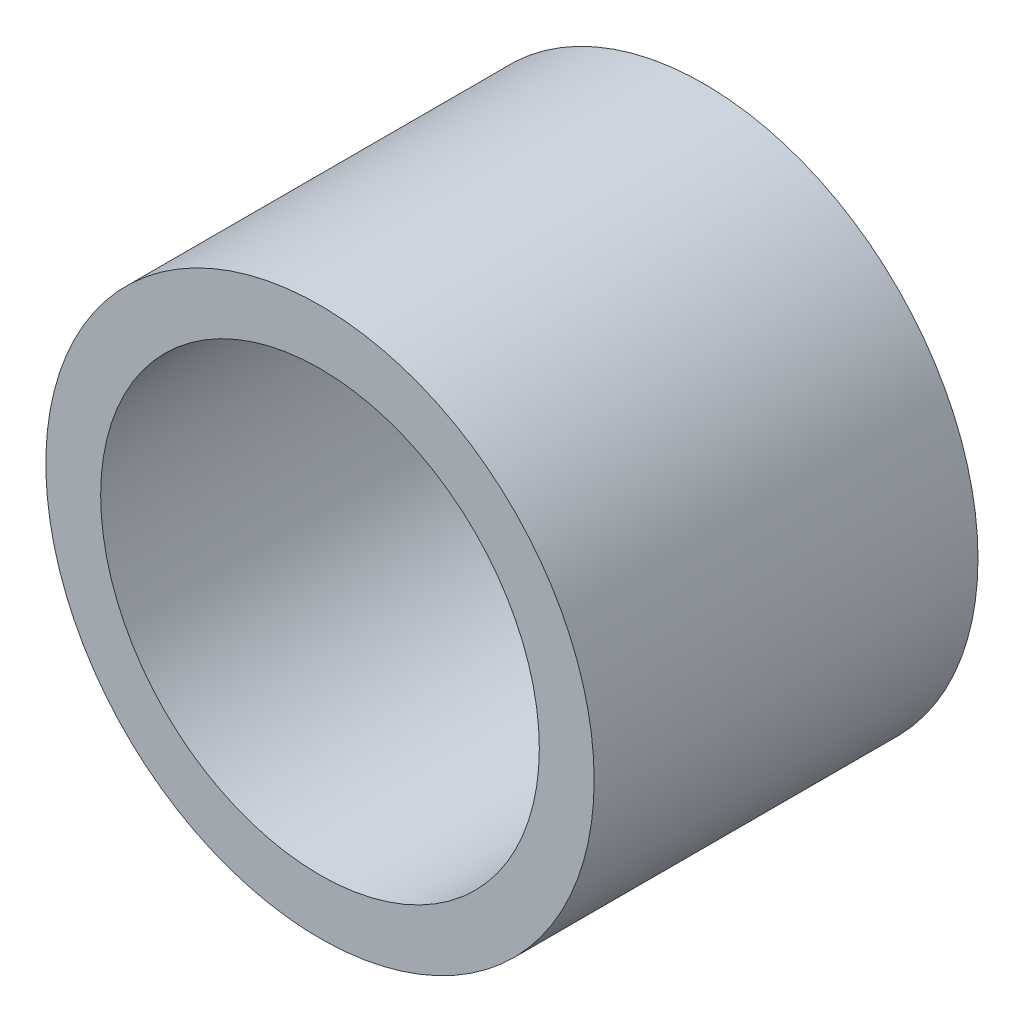
from build123d import *

# Parameters (mm, degrees)
CROQUIS1_R              = 5
CROQUIS1_R_2            = 4
SALIENTE_EXTRUIR1_DEPTH = 7


with BuildPart() as part:
    # Croquis1 → Saliente-Extruir1 (new body)
    with BuildSketch(Plane.XY):
        Circle(CROQUIS1_R)
        Circle(CROQUIS1_R_2, mode=Mode.SUBTRACT)
    extrude(amount=SALIENTE_EXTRUIR1_DEPTH)


solid = part.part
